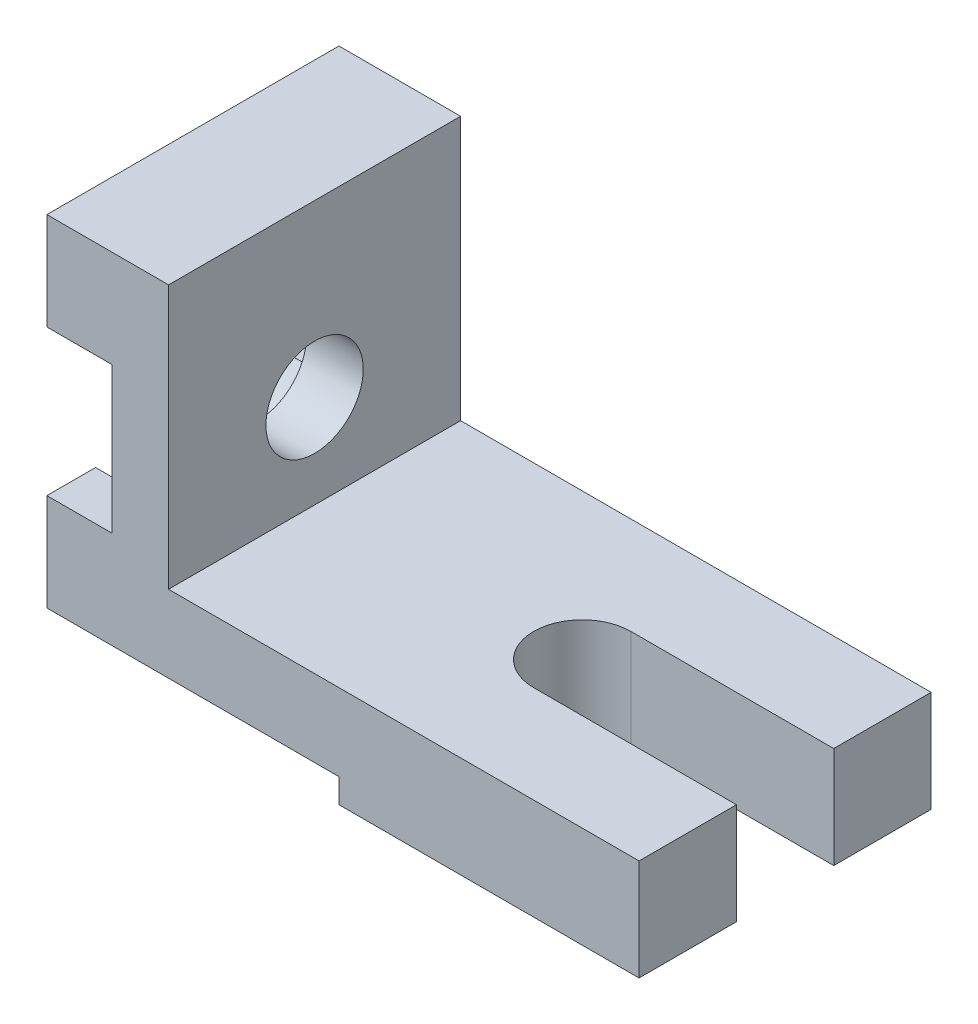
from build123d import *

# Parameters (mm, degrees)
BOSS_EXTRUDE1_DEPTH     = 72
CUT_EXTRUDE2_DEPTH      = 176.28548143
CUT_EXTRUDE2_DEPTH_BACK = 25
SKETCH3_W               = 50
SKETCH3_H               = 6
CUT_EXTRUDE4_DEPTH      = 72
CUT_EXTRUDE6_DEPTH      = 16
SKETCH5_R               = 12
CUT_EXTRUDE7_DEPTH      = 16


with BuildPart() as part:
    # Sketch1 → Boss-Extrude1 (new body)
    with BuildSketch(Plane.XY):
        Polygon((0, 0), (-146, 0), (-146, 90), (-116, 90), (-116, 25), (0, 25), align=None)
    extrude(amount=BOSS_EXTRUDE1_DEPTH)

    # Sketch2 → Cut-Extrude2 (cut, two sides: drawn at the far end of the back side and taken through both)
    with BuildSketch(Plane(origin=(0, 25, 0), x_dir=(1, 0, 0), z_dir=(0, 1, 0)).offset(-CUT_EXTRUDE2_DEPTH_BACK)):
        with BuildLine():
            Line((-50, -48), (0, -48))
            Line((0, -48), (0, -24))
            Line((0, -24), (-50, -24))
            ThreePointArc((-50, -24), (-62, -36), (-50, -48))
        make_face()
    extrude(amount=CUT_EXTRUDE2_DEPTH + CUT_EXTRUDE2_DEPTH_BACK, mode=Mode.SUBTRACT)

    # Sketch3 → Cut-Extrude4 (cut)
    with BuildSketch(Plane.ZY.offset(146)):
        with Locations((47, 3)):
            Rectangle(SKETCH3_W, SKETCH3_H)
    extrude(amount=-CUT_EXTRUDE4_DEPTH, mode=Mode.SUBTRACT)

    # Sketch4 → Cut-Extrude6 (cut)
    with BuildSketch(Plane.ZY.offset(146)):
        with BuildLine():
            Line((12, 66), (0, 66))
            Line((0, 66), (0, 30))
            Line((0, 30), (12, 30))
            ThreePointArc((12, 30), (36, 18), (60, 30))
            Line((60, 30), (72, 30))
            Line((72, 30), (72, 66))
            Line((72, 66), (60, 66))
            ThreePointArc((60, 66), (36, 78), (12, 66))
        make_face()
    extrude(amount=-CUT_EXTRUDE6_DEPTH, mode=Mode.SUBTRACT)

    # Sketch5 → Cut-Extrude7 (cut)
    with BuildSketch(Plane.ZY.offset(130)):
        with Locations((36, 48)):
            Circle(SKETCH5_R)
    extrude(amount=-CUT_EXTRUDE7_DEPTH, mode=Mode.SUBTRACT)


solid = part.part
